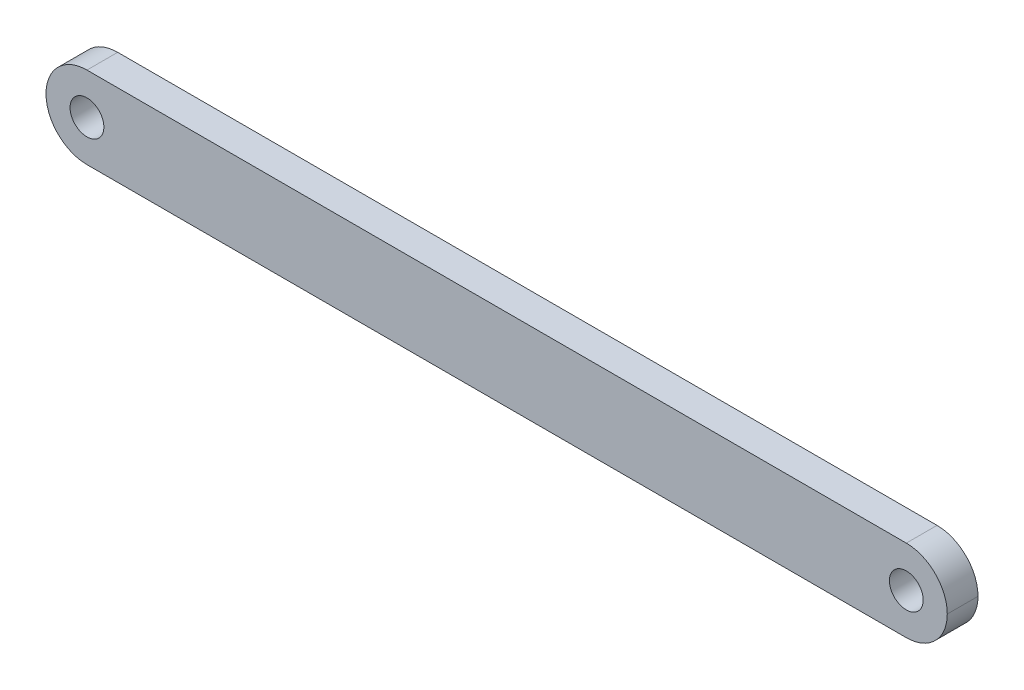
from build123d import *

# Parameters (mm, degrees)
SKETCH_1_R          = 1.65
EXTRUDE_1_DEPTH     = 3
CUT_EXTRUDE_1_DEPTH = 1


with BuildPart() as part:
    # 草图1 → 凸台-拉伸1 (new body)
    with BuildSketch(Plane(origin=(0, 0, 0), x_dir=(-1, 0, 0), z_dir=(0, 0, -1))):
        with BuildLine():
            Line((-55.860221974, 0), (24.13832066, 0))
            ThreePointArc((24.13832066, 0), (26.966394209, 1.171219344), (28.138320535, 3.999))
            ThreePointArc((28.138320535, 3.999), (26.96674766, 6.827427125), (24.138320535, 7.999))
            Line((24.138320535, 7.999), (-55.860222099, 7.999))
            ThreePointArc((-55.860222099, 7.999), (-58.688295648, 6.827780656), (-59.860221974, 4))
            ThreePointArc((-59.860221974, 4), (-58.688649099, 1.171572875), (-55.860221974, 0))
        make_face()
        with Locations((24.138809001, 3.998511534)):
            Circle(SKETCH_1_R, mode=Mode.SUBTRACT)
        with Locations((-55.859733508, 3.999511534)):
            Circle(SKETCH_1_R, mode=Mode.SUBTRACT)
    extrude(amount=-EXTRUDE_1_DEPTH)

    # 草图2 → 切除-拉伸1 (cut)
    with BuildSketch(Plane(origin=(0, 0, 0), x_dir=(-1, 0, 0), z_dir=(0, 0, -1))):
        with BuildLine():
            add(Edge.make_bspline(
                [(-6.832159624, 4.216174383), (-6.803511077, 4.201236427), (-6.747636843, 4.172102424), (-6.668059635, 4.125191596), (-6.595334633, 4.075750631), (-6.527444071, 4.026114772), (-6.465580721, 3.974383121), (-6.410436308, 3.920349964), (-6.360648688, 3.865364019), (-6.317221904, 3.808494179), (-6.279025067, 3.74989153), (-6.246012932, 3.689402257), (-6.217795729, 3.627158923), (-6.19543279, 3.562482093), (-6.177010999, 3.496321831), (-6.164335394, 3.42782385), (-6.157518476, 3.357439509), (-6.156229662, 3.309871207), (-6.155577092, 3.285785761)],
                knots=[0, 0, 0, 0, 1.272397273, 2.481599622, 3.635517121, 4.734568067, 5.792894095, 6.808321871, 7.773003508, 8.711915296, 9.623354172, 10.525449501, 11.423591555, 12.311487226, 13.218079475, 14.126165749, 15.051214107, 16, 16, 16, 16], degree=3))
            add(Edge.make_bspline(
                [(-6.155577092, 3.285785761), (-6.156348513, 3.252088028), (-6.157875444, 3.185387572), (-6.171175428, 3.08694146), (-6.191088406, 2.991329678), (-6.220167918, 2.898573187), (-6.257881309, 2.809183814), (-6.304358145, 2.723085041), (-6.35696935, 2.638865731), (-6.39922159, 2.58704633), (-6.420601131, 2.560825825)],
                knots=[0, 0, 0, 0, 1.025265484, 2.029385089, 3.018602448, 3.995076438, 4.983346944, 5.966715145, 6.97116228, 8, 8, 8, 8], degree=3))
            add(Edge.make_bspline(
                [(-6.420601131, 2.560825825), (-6.448437605, 2.530232051), (-6.503766571, 2.469422558), (-6.598549498, 2.390471748), (-6.702571382, 2.324122354), (-6.815429715, 2.27005046), (-6.936822816, 2.227964601), (-7.066724821, 2.197722083), (-7.205388974, 2.180399654), (-7.300694445, 2.177895664), (-7.349587509, 2.176611082)],
                knots=[0, 0, 0, 0, 0.954267603, 1.896743057, 2.838368354, 3.796610408, 4.779680527, 5.799409237, 6.871065594, 8, 8, 8, 8], degree=3))
            add(Edge.make_bspline(
                [(-7.349587509, 2.176611082), (-7.396600898, 2.177763559), (-7.488084177, 2.180006165), (-7.621242054, 2.195200596), (-7.745365124, 2.221828463), (-7.861175092, 2.258273072), (-7.967973786, 2.3056833), (-8.065456887, 2.364691709), (-8.155030859, 2.432923151), (-8.233977333, 2.51233723), (-8.304065777, 2.597395102), (-8.36563383, 2.685146712), (-8.416807908, 2.775600069), (-8.460135004, 2.867406436), (-8.493303026, 2.96185259), (-8.516275237, 3.058452604), (-8.530864551, 3.157037746), (-8.532805685, 3.2235694), (-8.533782221, 3.257039767)],
                knots=[0, 0, 0, 0, 1.256902934, 2.445805442, 3.576955095, 4.645999104, 5.686449165, 6.692658513, 7.68621702, 8.689161843, 9.678783111, 10.630372946, 11.551080876, 12.453998257, 13.34127905, 14.221779781, 15.105423033, 16, 16, 16, 16], degree=3))
            add(Edge.make_bspline(
                [(-8.533782221, 3.257039767), (-8.53320434, 3.281598959), (-8.532062243, 3.330136591), (-8.524157394, 3.40184592), (-8.511448933, 3.471642054), (-8.494189476, 3.539782798), (-8.47079845, 3.605772071), (-8.442556317, 3.669922544), (-8.409624364, 3.732306643), (-8.371543199, 3.793265524), (-8.327241175, 3.851945037), (-8.277077525, 3.909341031), (-8.220049657, 3.964562898), (-8.156791998, 4.018285323), (-8.088027458, 4.071461297), (-8.011969928, 4.121217026), (-7.93063566, 4.17107499), (-7.872830255, 4.200883316), (-7.843177253, 4.216174383)],
                knots=[0, 0, 0, 0, 0.941657376, 1.861047343, 2.762797495, 3.66048619, 4.553285746, 5.444104102, 6.34607688, 7.256116206, 8.197091036, 9.162375105, 10.176350973, 11.237807142, 12.343728897, 13.50695164, 14.721116704, 16, 16, 16, 16], degree=3))
            add(Edge.make_bspline(
                [(-7.843177253, 4.216174383), (-7.883768627, 4.238309151), (-7.96236489, 4.281168259), (-8.066434331, 4.359915065), (-8.155824955, 4.44520288), (-8.228079672, 4.538832675), (-8.284951901, 4.637879549), (-8.323970505, 4.741723801), (-8.350366989, 4.848439915), (-8.352981816, 4.921346111), (-8.354295041, 4.957961242)],
                knots=[0, 0, 0, 0, 1.166880483, 2.259407225, 3.286803203, 4.280235371, 5.237608625, 6.161067461, 7.076446754, 8, 8, 8, 8], degree=3))
            add(Edge.make_bspline(
                [(-8.354295041, 4.957961242), (-8.352659617, 4.9952588), (-8.349372129, 5.070233397), (-8.322788809, 5.18183952), (-8.279468742, 5.291456085), (-8.220547745, 5.398551798), (-8.147160529, 5.499502013), (-8.059113983, 5.590042959), (-7.958510686, 5.669354442), (-7.845852819, 5.735930614), (-7.724616584, 5.790114273), (-7.59670086, 5.827492696), (-7.464334367, 5.851928813), (-7.374236647, 5.854695467), (-7.328553855, 5.856098261)],
                knots=[0, 0, 0, 0, 0.888701115, 1.786444228, 2.72001202, 3.692817113, 4.693886446, 5.687152267, 6.695133018, 7.739871481, 8.800368666, 9.853104506, 10.91144658, 12, 12, 12, 12], degree=3))
            add(Edge.make_bspline(
                [(-7.328553855, 5.856098261), (-7.28405004, 5.854651918), (-7.196293587, 5.851799894), (-7.06729896, 5.828013016), (-6.943874082, 5.788283496), (-6.826444583, 5.734386273), (-6.717112716, 5.667999332), (-6.620510406, 5.587598458), (-6.535177824, 5.497456907), (-6.46459343, 5.396537304), (-6.406430541, 5.28985311), (-6.36592964, 5.178230589), (-6.339977666, 5.064081531), (-6.336704302, 4.986843527), (-6.335064272, 4.948145537)],
                knots=[0, 0, 0, 0, 1.072916533, 2.115669174, 3.151510826, 4.193348718, 5.225979165, 6.227137561, 7.216255879, 8.211077061, 9.189680878, 10.138522389, 11.067357538, 12, 12, 12, 12], degree=3))
            add(Edge.make_bspline(
                [(-6.335064272, 4.948145537), (-6.336498833, 4.910168873), (-6.339316228, 4.835584863), (-6.363016168, 4.726858343), (-6.402929481, 4.625036304), (-6.457423644, 4.528963352), (-6.528449132, 4.440381854), (-6.615057865, 4.358165384), (-6.716559343, 4.281638556), (-6.792820229, 4.238452192), (-6.832159624, 4.216174383)],
                knots=[0, 0, 0, 0, 0.975232327, 1.915300861, 2.843280834, 3.77672583, 4.742871857, 5.749627742, 6.839139064, 8, 8, 8, 8], degree=3))
        make_face()
        with BuildLine():
            add(Edge.make_bspline(
                [(-7.3460819, 5.497123902), (-7.370632706, 5.496472461), (-7.418664817, 5.495197959), (-7.489093488, 5.488539322), (-7.556065856, 5.475586105), (-7.620281656, 5.458347394), (-7.680860468, 5.435059405), (-7.738625023, 5.407664396), (-7.792592213, 5.374358331), (-7.843413516, 5.336997133), (-7.88916429, 5.295904227), (-7.929768842, 5.253090508), (-7.963496956, 5.207715116), (-7.992138066, 5.160906756), (-8.012919583, 5.11127618), (-8.028483887, 5.060345003), (-8.039005278, 5.007469619), (-8.039793669, 4.971333109), (-8.040192477, 4.953053389)],
                knots=[0, 0, 0, 0, 1.203892937, 2.355340988, 3.463153438, 4.544400666, 5.610487187, 6.640501085, 7.674077295, 8.714426146, 9.728707835, 10.68524104, 11.601827946, 12.495867327, 13.368432065, 14.231010473, 15.105153427, 16, 16, 16, 16], degree=3))
            add(Edge.make_bspline(
                [(-8.040192477, 4.953053389), (-8.03950511, 4.93477288), (-8.038146774, 4.898647967), (-8.027641646, 4.845302101), (-8.011984792, 4.792880464), (-7.98733413, 4.742629553), (-7.957767772, 4.692806194), (-7.921276296, 4.644655608), (-7.877787268, 4.598010223), (-7.828759828, 4.553266782), (-7.77534829, 4.511368019), (-7.718764246, 4.474994837), (-7.659717855, 4.444560727), (-7.598815786, 4.419231322), (-7.535437339, 4.399541384), (-7.469970865, 4.385572738), (-7.402405363, 4.376890741), (-7.356624782, 4.37585372), (-7.333461708, 4.37532903)],
                knots=[0, 0, 0, 0, 0.873023192, 1.725219244, 2.590779336, 3.480155217, 4.391973325, 5.357036234, 6.360879153, 7.436073238, 8.526419356, 9.601555421, 10.645666583, 11.697338044, 12.750135903, 13.812665442, 14.89329948, 16, 16, 16, 16], degree=3))
            add(Edge.make_bspline(
                [(-7.333461708, 4.37532903), (-7.303711604, 4.376201897), (-7.244505236, 4.37793901), (-7.157225905, 4.394090184), (-7.07236326, 4.419496102), (-6.990824356, 4.454256068), (-6.914719771, 4.497883928), (-6.846879702, 4.550116946), (-6.78788281, 4.609749043), (-6.738342199, 4.675851879), (-6.699932353, 4.746203467), (-6.670030545, 4.81680376), (-6.65256933, 4.888405991), (-6.650291763, 4.936372955), (-6.649166836, 4.960064607)],
                knots=[0, 0, 0, 0, 1.076279235, 2.141928126, 3.20205304, 4.278698113, 5.344010996, 6.36967002, 7.368914609, 8.37248503, 9.349703398, 10.264243087, 11.142681841, 12, 12, 12, 12], degree=3))
            add(Edge.make_bspline(
                [(-6.649166836, 4.960064607), (-6.649698734, 4.976692643), (-6.650754474, 5.009696911), (-6.65945453, 5.058435276), (-6.673830363, 5.10606486), (-6.693293443, 5.152979131), (-6.718903238, 5.198519863), (-6.749267425, 5.243402951), (-6.786151927, 5.286618714), (-6.82754836, 5.329174263), (-6.874493769, 5.368558287), (-6.926897681, 5.403192997), (-6.984491431, 5.432605353), (-7.047276381, 5.456494108), (-7.115021306, 5.474436458), (-7.18741418, 5.487872806), (-7.265058627, 5.495445917), (-7.318488378, 5.496552443), (-7.3460819, 5.497123902)],
                knots=[0, 0, 0, 0, 0.814439003, 1.616544685, 2.417341072, 3.248991801, 4.09997495, 4.973547432, 5.9003056, 6.880240646, 7.880314356, 8.896779544, 9.951930927, 11.043077905, 12.18215768, 13.381699519, 14.647792085, 16, 16, 16, 16], degree=3))
        make_face(mode=Mode.SUBTRACT)
        with BuildLine():
            add(Edge.make_bspline(
                [(-7.325749368, 4.016354671), (-7.356875154, 4.01580103), (-7.41793635, 4.014714921), (-7.507393278, 4.00262542), (-7.593246444, 3.985796027), (-7.67520638, 3.960265189), (-7.753238477, 3.927068698), (-7.82776516, 3.887134158), (-7.898216289, 3.839928715), (-7.963619015, 3.7860521), (-8.023342345, 3.727992646), (-8.075740645, 3.666530511), (-8.120238165, 3.602807978), (-8.156071416, 3.536015749), (-8.185483148, 3.467568138), (-8.204797026, 3.395760542), (-8.217178737, 3.321973429), (-8.218841369, 3.271813331), (-8.219679657, 3.24652294)],
                knots=[0, 0, 0, 0, 1.140299081, 2.23698856, 3.303958914, 4.344563908, 5.37730929, 6.408454204, 7.439741482, 8.480804886, 9.510774543, 10.48932336, 11.43758569, 12.353841022, 13.263987381, 14.161954604, 15.073269652, 16, 16, 16, 16], degree=3))
            add(Edge.make_bspline(
                [(-8.219679657, 3.24652294), (-8.218316398, 3.215092034), (-8.215611724, 3.152733851), (-8.194155085, 3.06057078), (-8.15971955, 2.971349725), (-8.111694334, 2.885797772), (-8.052226761, 2.805847666), (-7.979100293, 2.73615889), (-7.896859456, 2.674237412), (-7.802721602, 2.624156878), (-7.699893136, 2.584162023), (-7.588401407, 2.55660606), (-7.469846488, 2.538364611), (-7.387986896, 2.536526429), (-7.3460819, 2.53558544)],
                knots=[0, 0, 0, 0, 0.898778495, 1.783155532, 2.693654817, 3.627872908, 4.583023416, 5.533784346, 6.509005473, 7.520592997, 8.575161974, 9.658835044, 10.801527049, 12, 12, 12, 12], degree=3))
            add(Edge.make_bspline(
                [(-7.3460819, 2.53558544), (-7.313331532, 2.536214249), (-7.249523313, 2.537439369), (-7.156437364, 2.548253664), (-7.068592816, 2.565403288), (-6.986160017, 2.590346834), (-6.908216178, 2.620796811), (-6.836082823, 2.659968892), (-6.767904296, 2.704521215), (-6.707040174, 2.757379372), (-6.651606965, 2.813858867), (-6.603273672, 2.87364891), (-6.561316121, 2.935124542), (-6.528385165, 2.999675027), (-6.502058912, 3.066061941), (-6.483135357, 3.134897453), (-6.471459142, 3.206392685), (-6.470278246, 3.254891757), (-6.469679657, 3.279475665)],
                knots=[0, 0, 0, 0, 1.224942928, 2.386581632, 3.501229538, 4.569074225, 5.605009692, 6.626002462, 7.634866581, 8.645888296, 9.63523824, 10.59253846, 11.518950513, 12.414518923, 13.29783783, 14.186679152, 15.080837789, 16, 16, 16, 16], degree=3))
            add(Edge.make_bspline(
                [(-6.469679657, 3.279475665), (-6.470585505, 3.303353005), (-6.47237168, 3.35043495), (-6.483708372, 3.420201477), (-6.503624249, 3.487604291), (-6.530951646, 3.553454297), (-6.567332608, 3.616417248), (-6.610177478, 3.678133419), (-6.661871597, 3.736889864), (-6.720284193, 3.79314296), (-6.783943154, 3.845158696), (-6.851610299, 3.891173135), (-6.922764761, 3.929925251), (-6.997255971, 3.961441747), (-7.074918527, 3.986229216), (-7.155695306, 4.003545211), (-7.239680881, 4.014444814), (-7.296735752, 4.01571086), (-7.325749368, 4.016354671)],
                knots=[0, 0, 0, 0, 0.917430815, 1.809013306, 2.70690318, 3.612392954, 4.541220862, 5.495268465, 6.494511384, 7.542276156, 8.608045339, 9.649016899, 10.681629292, 11.715607085, 12.752076957, 13.808767841, 14.885711793, 16, 16, 16, 16], degree=3))
        make_face(mode=Mode.SUBTRACT)
    extrude(amount=-CUT_EXTRUDE_1_DEPTH, mode=Mode.SUBTRACT)


solid = part.part
